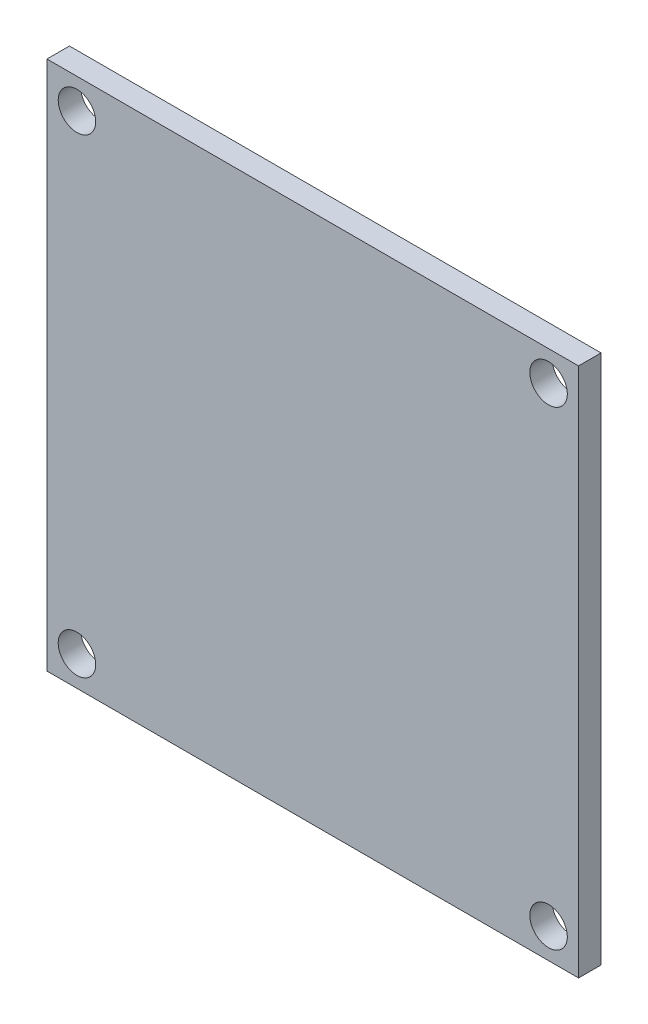
from build123d import *

# Parameters (mm, degrees)
SKETCH_1_W          = 70.9
SKETCH_1_H          = 70.7
EXTRUDE_1_DEPTH     = 3
SKETCH_2_R          = 2.5
CUT_EXTRUDE_1_DEPTH = 51.153015861


with BuildPart() as part:
    # 草图1 → 凸台-拉伸1 (new body)
    with BuildSketch(Plane.XY):
        Rectangle(SKETCH_1_W, SKETCH_1_H)
    extrude(amount=EXTRUDE_1_DEPTH)

    # 草图2 → 切除-拉伸1 (cut, through all)
    with BuildSketch(Plane(origin=(0, 0, 0), x_dir=(-1, 0, 0), z_dir=(0, 0, -1))):
        with Locations((-31.45, 31.35)):
            Circle(SKETCH_2_R)
        with Locations((-31.45, -31.35)):
            Circle(SKETCH_2_R)
        with Locations((31.45, -31.35)):
            Circle(SKETCH_2_R)
        with Locations((31.45, 31.35)):
            Circle(SKETCH_2_R)
    extrude(amount=-CUT_EXTRUDE_1_DEPTH, mode=Mode.SUBTRACT)


solid = part.part
